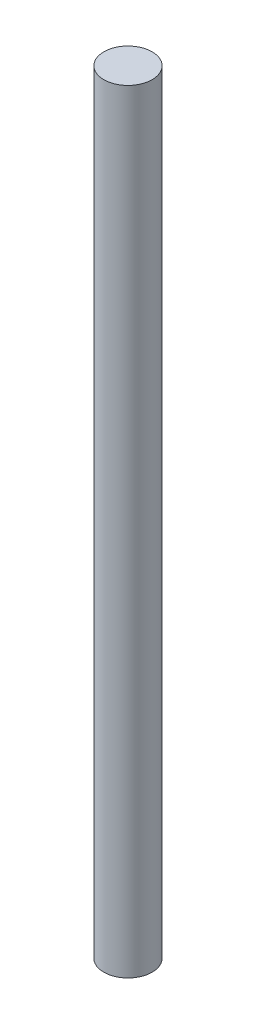
from build123d import *

# Parameters (mm, degrees)
SKETCH_1_R      = 2.5
EXTRUDE_1_DEPTH = 80


with BuildPart() as part:
    # 草图1 → 凸台-拉伸1 (new body)
    with BuildSketch(Plane(origin=(0, 0, 0), x_dir=(1, 0, 0), z_dir=(0, 1, 0))):
        with Locations(Location((0, 0, 0), (0, 0, 270))):
            Circle(SKETCH_1_R)
    extrude(amount=EXTRUDE_1_DEPTH)


solid = part.part
